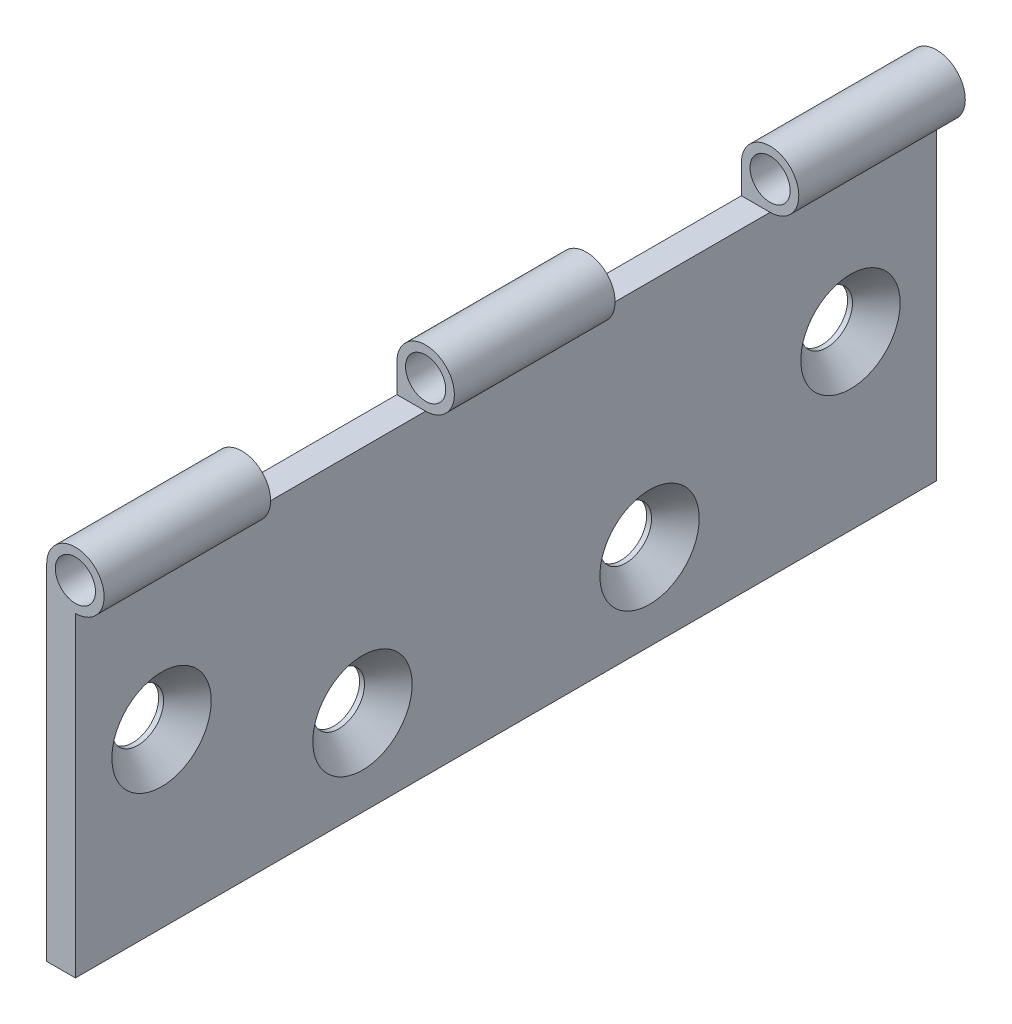
from build123d import *

# Parameters (mm, degrees)
SKETCH1_W                                      = 5
SKETCH1_H                                      = 60
EXTRUDE_THIN1_DEPTH                            = 75
SKETCH2_R                                      = 5
SKETCH3_R                                      = 3.5
CUT_EXTRUDE1_DEPTH                             = 164.783393542
CSK_FOR_M8_FLAT_HEAD_MACHINE_SCREW1_AT_2_COUNT = 2
CSK_FOR_M8_FLAT_HEAD_MACHINE_SCREW1_AT_2_PITCH = 38.078865529
F_2CUTS_DEPTH                                  = 100.373034572
F_2CUTS_DEPTH_BACK                             = 100.373034572
SKETCH8_W                                      = 32
SKETCH8_H                                      = 10


with BuildPart() as part:
    # Sketch1 → Extrude-Thin1 (new, symmetric)
    with BuildSketch(Plane.XY):
        with Locations((2.5, 30)):
            Rectangle(SKETCH1_W, SKETCH1_H)
    extrude(amount=EXTRUDE_THIN1_DEPTH, both=True)

    # Sweep1: sweep along a curve in space
    with BuildLine() as sweep1_path:
        Line((5, 60, 75), (5, 60, -75))
    # Sketch2 → Sweep1 (sweep)
    with BuildSketch(Plane.XY.offset(75)):
        with Locations((5, 60)):
            Circle(SKETCH2_R)
    sweep(path=sweep1_path.line)

    # Sketch3 → Cut-Extrude1 (cut, through all)
    with BuildSketch(Plane.XY.offset(75)):
        with Locations((5, 60)):
            Circle(SKETCH3_R)
    extrude(amount=-CUT_EXTRUDE1_DEPTH, mode=Mode.SUBTRACT)

    # Sketch5 → CSK for M8 Flat Head Machine Screw1 (revolve, cut)
    with BuildSketch(Plane(origin=(5, 15, 25), x_dir=(0, 0, -1), z_dir=(0, 1, 0))):
        Polygon((0, 0), (0, 5), (4.5, 5), (4.5, 4.15), (8.65, 0), align=None)
    csk_for_m8_flat_head_machine_screw1 = revolve(axis=Axis((11.35, 15, 25), (-1, 0, 0)), mode=Mode.SUBTRACT)

    # CSK for M8 Flat Head Machine Screw1 at 2: CSK for M8 Flat Head Machine Screw1 ×2
    with Locations(*[Vector(0, 0.3939192985791676, 0.9191450300180579) * (i * CSK_FOR_M8_FLAT_HEAD_MACHINE_SCREW1_AT_2_PITCH) for i in range(1, CSK_FOR_M8_FLAT_HEAD_MACHINE_SCREW1_AT_2_COUNT)]):
        add(csk_for_m8_flat_head_machine_screw1, mode=Mode.SUBTRACT)

    # Mirror1: CSK for M8 Flat Head Machine Screw1 across plane
    add(csk_for_m8_flat_head_machine_screw1.mirror(Plane.XY), mode=Mode.SUBTRACT)

    # Mirror1 copy 1 sketch → Mirror1 copy 1 (revolve, cut)
    with BuildSketch(Plane(origin=(5, 30, -60), x_dir=(0, 0, 1), z_dir=(0, 1, 0))):
        Polygon((0, 0), (0, -5), (4.5, -5), (4.5, -4.15), (8.65, 0), align=None)
    revolve(axis=Axis((11.35, 30, -60), (1, 0, 0)), mode=Mode.SUBTRACT)

    # Sketch8 → 2Cuts (cut, two sides: drawn at the far end of the back side and taken through both)
    with BuildSketch(Plane(origin=(5, 0, 0), x_dir=(0, 0, -1), z_dir=(1, 0, 0)).offset(-F_2CUTS_DEPTH_BACK)):
        with Locations((-30, 60)):
            Rectangle(SKETCH8_W, SKETCH8_H)
        with Locations((30, 60)):
            Rectangle(SKETCH8_W, SKETCH8_H)
    extrude(amount=F_2CUTS_DEPTH + F_2CUTS_DEPTH_BACK, mode=Mode.SUBTRACT)


solid = part.part
